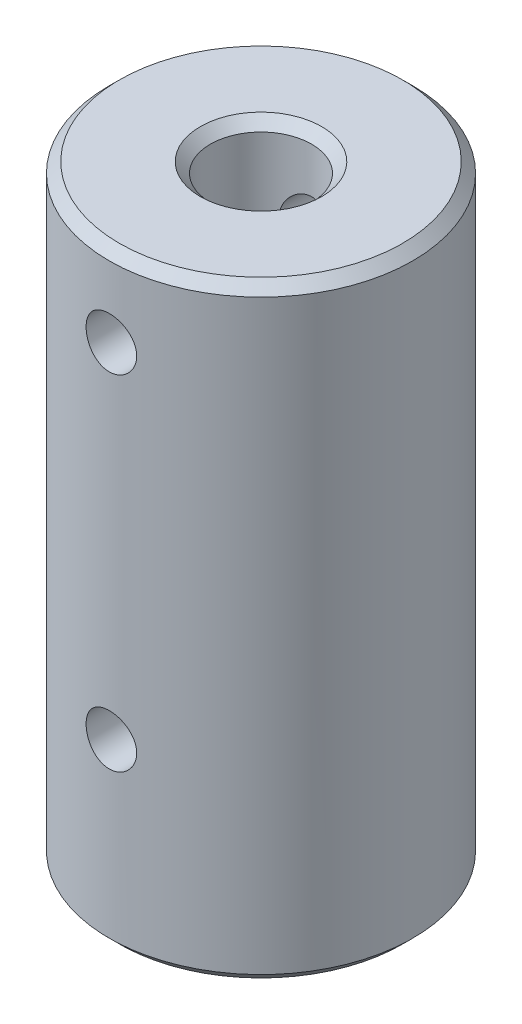
from build123d import *

# Parameters (mm, degrees)
CHAMFER_1_SIZE     = 0.5
HOLE_WIZARD_M3_2_D = 2.5


with BuildPart() as part:
    # 草图1 → 旋转1 (revolve)
    with BuildSketch(Plane.XY, mode=Mode.PRIVATE) as revolve_1_sk:
        Polygon((5, 0), (5, 20), (2.5, 20), (2.5, 30), (7.5, 30), (7.5, 0), align=None)
    revolve(revolve_1_sk.sketch.rotate(Axis((0, 0, 0), (0, 1, 0)), 90), axis=Axis((0, 0, 0), (0, 1, 0)))

    # 倒角1
    chamfer_1_edges = [part.edges().sort_by_distance(p)[0] for p in [
        (0, 0, 7.5),
        (0, 30, 7.5),
        (0, 30, 2.5),
        (0, 0, 5),
    ]]
    chamfer(chamfer_1_edges, length=CHAMFER_1_SIZE)

    # M3 螺纹孔2 (through all)
    with Locations(Plane.XY.offset(7.5)):
        with Locations((0, 26), (0, 9)):
            Hole(HOLE_WIZARD_M3_2_D / 2)


solid = part.part
